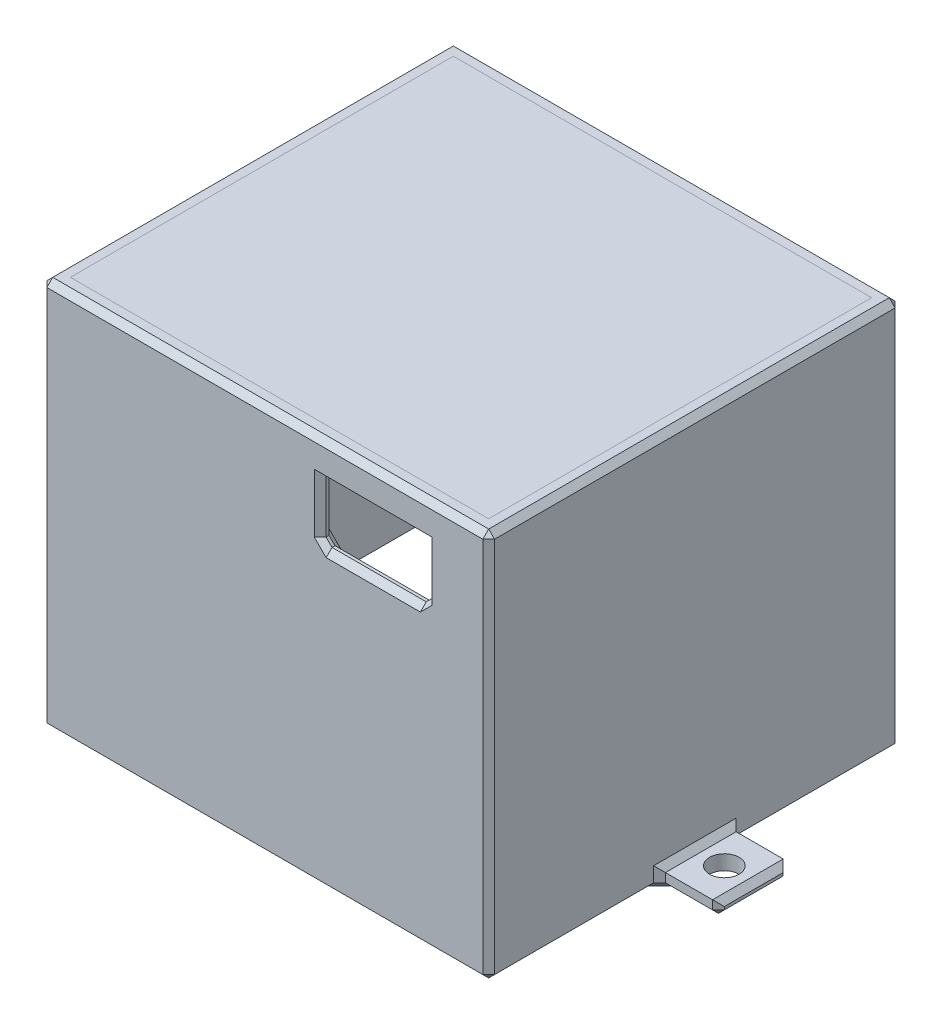
from build123d import *

# Parameters (mm, degrees)
SKETCH_1_W           = 70
SKETCH_1_H           = 64
EXTRUDE_1_DEPTH      = 6
SKETCH_2_W           = 71
SKETCH_2_H           = 65
SKETCH_2_W_2         = 70
SKETCH_2_H_2         = 64
EXTRUDE_2_DEPTH      = 6
EXTRUDE_3_DEPTH      = 60
EXTRUDE_3_DEPTH_BACK = 6
SKETCH_2_4_W         = 76
SKETCH_2_4_H         = 70
SKETCH_2_4_W_2       = 71
SKETCH_2_4_H_2       = 65
SKETCH_6_W           = 18
SKETCH_6_H           = 10
CUT_EXTRUDE_2_DEPTH  = 117
SKETCH_7_W           = 10
SKETCH_7_H           = 12
SKETCH_7_R           = 2.5
EXTRUDE_4_DEPTH      = 2.5
CHAMFER_1_SIZE       = 1


with BuildPart() as part:
    # 草图1 → 凸台-拉伸1 (new body)
    with BuildSketch(Plane(origin=(0, 0, 0), x_dir=(1, 0, 0), z_dir=(0, 1, 0))):
        with Locations((35, -32)):
            Rectangle(SKETCH_1_W, SKETCH_1_H)
    extrude(amount=EXTRUDE_1_DEPTH)

    # 草图2 → 凸台-拉伸2 (add)
    with BuildSketch(Plane.XZ):
        with Locations((35, 32)):
            Rectangle(SKETCH_2_W, SKETCH_2_H)
        with Locations((35, 32)):
            Rectangle(SKETCH_2_W_2, SKETCH_2_H_2, mode=Mode.SUBTRACT)
    extrude(amount=-EXTRUDE_2_DEPTH)


with BuildPart() as body_2:
    # 草图2<4> → 凸台-拉伸3 (new, two sides: drawn at the far end of the back side and taken through both)
    with BuildSketch(Plane.XZ.offset(-EXTRUDE_3_DEPTH_BACK)):
        with Locations((35, 32)):
            Rectangle(SKETCH_2_4_W, SKETCH_2_4_H)
        with Locations((35, 32)):
            Rectangle(SKETCH_2_4_W_2, SKETCH_2_4_H_2, mode=Mode.SUBTRACT)
    extrude(amount=EXTRUDE_3_DEPTH + EXTRUDE_3_DEPTH_BACK)

    # 草图6 → 切除-拉伸2 (cut)
    with BuildSketch(Plane(origin=(0, 0, -3), x_dir=(-1, 0, 0), z_dir=(0, 0, -1))):
        with Locations((-53.406339693, -5)):
            Rectangle(SKETCH_6_W, SKETCH_6_H)
    extrude(amount=-CUT_EXTRUDE_2_DEPTH, mode=Mode.SUBTRACT)

    # 草图7 → 凸台-拉伸4 (add)
    # profile 1 of 2: a face of its own
    with BuildSketch(Plane.XZ.offset(60)):
        with Locations((-8, 32)):
            Rectangle(SKETCH_7_W, SKETCH_7_H)
        with Locations((-8, 32)):
            Circle(SKETCH_7_R, mode=Mode.SUBTRACT)
    # profile 2 of 2: a face of its own
    with BuildSketch(Plane.XZ.offset(60)):
        with Locations((78, 32)):
            Rectangle(SKETCH_7_W, SKETCH_7_H)
        with Locations((78, 32)):
            Circle(SKETCH_7_R, mode=Mode.SUBTRACT)
    extrude(amount=-EXTRUDE_4_DEPTH)

    # 倒角1
    chamfer_1_edges = [body_2.edges().sort_by_distance(p)[0] for p in [
        (-8, -60, 26),
        (-8, -60, 38),
        (78, -60, 38),
        (78, -60, 26),
        (-3, -60, 11.5),
        (-3, 6, 32),
        (-3, -58.75, 26),
        (-3, -57.5, 32),
        (-3, -58.75, 38),
        (-3, -60, 52.5),
        (35, 6, 67),
        (-3, -27, 67),
        (35, -60, 67),
        (73, -60, 52.5),
        (73, -27, 67),
        (73, 6, 32),
        (73, -58.75, 38),
        (73, -57.5, 32),
        (73, -58.75, 26),
        (73, -60, 11.5),
        (35, 6, -3),
        (-3, -27, -3),
        (35, -60, -3),
        (73, -27, -3),
        (-13, -58.75, 26),
        (-13, -57.5, 32),
        (-13, -58.75, 38),
        (-13, -60, 32),
        (83, -58.75, 38),
        (83, -57.5, 32),
        (83, -58.75, 26),
        (83, -60, 32),
        (44.406339693, -5, 64.5),
        (62.406339693, -5, 64.5),
        (53.406339693, 0, 67),
        (44.406339693, -5, 67),
        (62.406339693, -5, 67),
        (53.406339693, -10, 64.5),
        (62.406339693, -10, 65.75),
        (53.406339693, -10, 67),
        (44.406339693, -10, 65.75),
        (53.406339693, -10, -0.5),
        (44.406339693, -10, -1.75),
        (53.406339693, -10, -3),
        (62.406339693, -10, -1.75),
        (44.406339693, -5, -0.5),
        (62.406339693, -5, -0.5),
        (62.406339693, -5, -3),
        (44.406339693, -5, -3),
        (53.406339693, 0, -0.5),
        (62.406339693, 0, -1.75),
        (53.406339693, 0, -3),
        (44.406339693, 0, -1.75),
    ]]
    chamfer(chamfer_1_edges, length=CHAMFER_1_SIZE)


solid = Compound([part.part, body_2.part])
